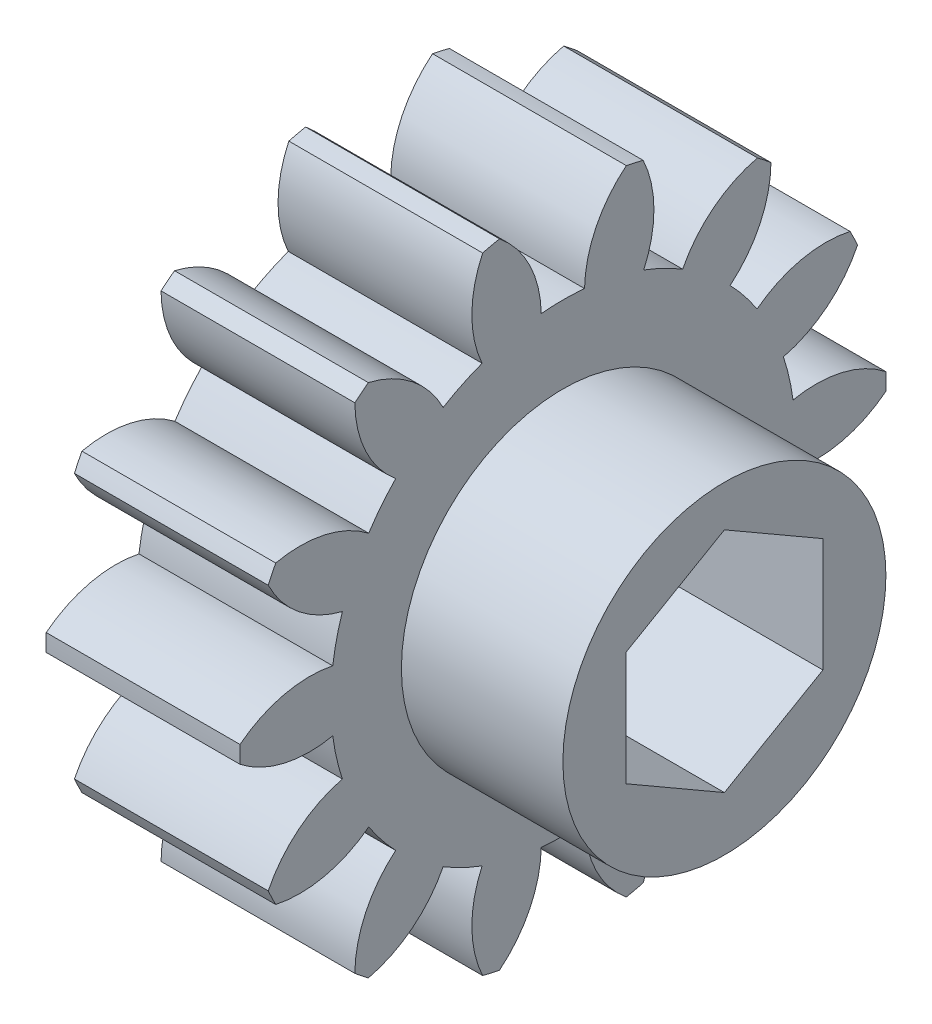
from build123d import *

# Parameters (mm, degrees)
BASPROSKE_W         = 12
BASPROSKE_H         = 20
TOOTHCUT_DEPTH      = 31.724582991
TEETHCUTS_COUNT     = 14
TEETHCUTS_ANGLE     = 334.285714286
BORSKE_R            = 0.4
BORE_DEPTH          = 50.0000508
SKETCH1_R           = 10
BOSS_EXTRUDE1_DEPTH = 10
CUT_EXTRUDE1_START  = -22
CUT_EXTRUDE1_DEPTH  = 22


with BuildPart() as part:
    # BasProSke → Base-Revolve (revolve)
    with BuildSketch(Plane(origin=(0, 0, 0), x_dir=(1, 0, 0), z_dir=(0, 1, 0)), mode=Mode.PRIVATE) as base_revolve_sk:
        with Locations((6, 10)):
            Rectangle(BASPROSKE_W, BASPROSKE_H)
    revolve(base_revolve_sk.sketch.rotate(Axis((-10, 0, 0), (1, 0, 0)), 180), axis=Axis((-10, 0, 0), (1, 0, 0)))

    # TooCutSke → ToothCut (cut, through all)
    with BuildSketch(Plane(origin=(0, 0, 0), x_dir=(0, 0, -1), z_dir=(1, 0, 0))):
        with BuildLine():
            ThreePointArc((1.339503949, 14.311450142), (0, 14.374), (-1.339503949, 14.311450142))
            ThreePointArc((-1.339503949, 14.311450142), (-2.055976555, 17.261705303), (-3.954182827, 19.631125371))
            ThreePointArc((-3.954182827, 19.631125371), (0, 20.0254), (3.954182827, 19.631125371))
            ThreePointArc((3.954182827, 19.631125371), (2.055976555, 17.261705303), (1.339503949, 14.311450142))
        make_face()
    toothcut = extrude(amount=TOOTHCUT_DEPTH, mode=Mode.SUBTRACT)

    # TeethCuts: ToothCut ×14 about axis
    teethcuts_axis = Axis((-10, 0, 0), (1, 0, 0))
    for i in range(1, TEETHCUTS_COUNT):
        add(toothcut.rotate(teethcuts_axis, i * TEETHCUTS_ANGLE / (TEETHCUTS_COUNT - 1)), mode=Mode.SUBTRACT)

    # BorSke → Bore (cut, symmetric)
    with BuildSketch(Plane(origin=(0, 0, 0), x_dir=(0, 0, -1), z_dir=(1, 0, 0))):
        with Locations(Location((0, 0, 0), (0, 0, 180))):
            Circle(BORSKE_R)
    extrude(amount=BORE_DEPTH, both=True, mode=Mode.SUBTRACT)

    # Sketch1 → Boss-Extrude1 (add)
    with BuildSketch(Plane(origin=(12, 0, 0), x_dir=(0, 0, -1), z_dir=(1, 0, 0))):
        with Locations(Location((0, -0.4, 0), (0, 0, 180))):
            Circle(SKETCH1_R)
    extrude(amount=BOSS_EXTRUDE1_DEPTH)

    # Sketch2 → Cut-Extrude1 (cut)
    with BuildSketch(Plane(origin=(22, 0, 0), x_dir=(0, 0, -1), z_dir=(1, 0, 0)).offset(CUT_EXTRUDE1_START)):
        Polygon((6.1, 3.521836642), (0, 7.043673284), (-6.1, 3.521836642), (-6.1, -3.521836642), (0, -7.043673284), (6.1, -3.521836642), align=None)
    extrude(amount=CUT_EXTRUDE1_DEPTH, mode=Mode.SUBTRACT)


solid = part.part
